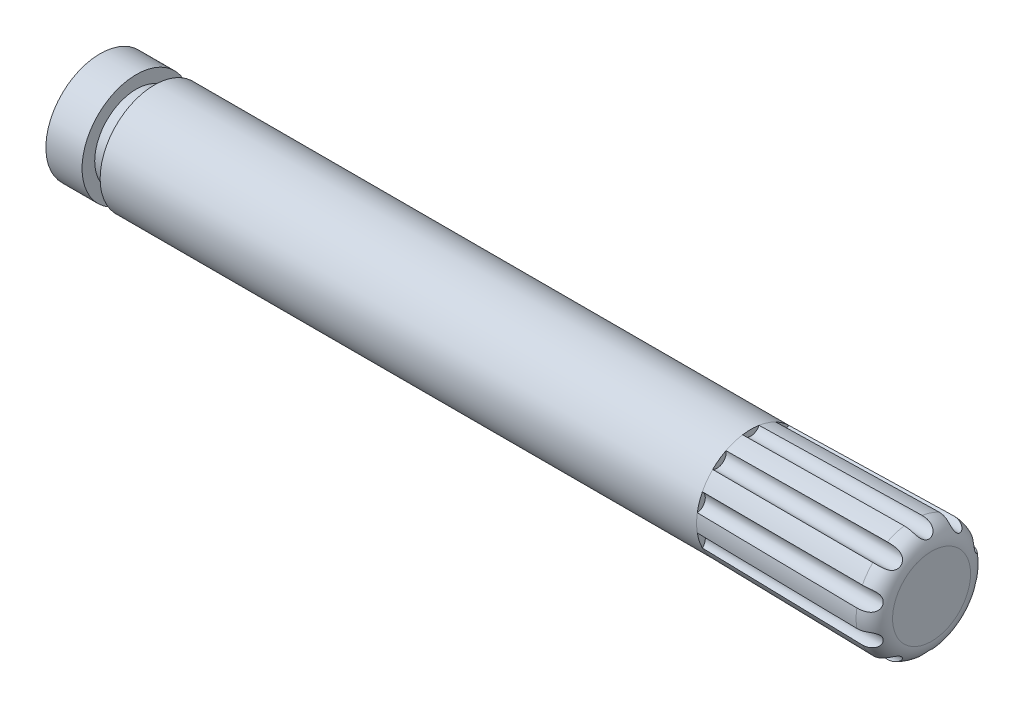
from build123d import *

# Parameters (mm, degrees)
SKETCH1_R                = 1.5
EXTRUDE1_DEPTH           = 18
EXTRUDE1_OTHER_WAY_DEPTH = 5
EXTRUDE1_OTHER_WAY_TAPER = -1
FILLET1_R                = 0.5
SKETCH2_R                = 0.25
CUT_EXTRUDE1_DEPTH       = 5
CIRPATTERN1_COUNT        = 10
SKETCH3_W                = 0.5
SKETCH3_H                = 0.930924855


with BuildPart() as part:
    # Sketch1 → Extrude1 (new body)
    with BuildSketch(Plane(origin=(0, 0, 0), x_dir=(0, 0, -1), z_dir=(1, 0, 0))):
        Circle(SKETCH1_R)
    extrude(amount=-EXTRUDE1_DEPTH)

    # Sketch1 → Extrude1 other way (add)
    with BuildSketch(Plane(origin=(0, 0, 0), x_dir=(0, 0, -1), z_dir=(1, 0, 0))):
        Circle(SKETCH1_R)
    extrude(amount=EXTRUDE1_OTHER_WAY_DEPTH, taper=EXTRUDE1_OTHER_WAY_TAPER)

    # Fillet1
    fillet1_edges = [part.edges().sort_by_distance(p)[0] for p in [
        (5, 0, 1.587275325),
    ]]
    fillet(fillet1_edges, radius=FILLET1_R)

    # Sketch2 → Cut-Extrude1 (cut)
    with BuildSketch(Plane(origin=(5, 0, 0), x_dir=(0, 0, -1), z_dir=(1, 0, 0))):
        with Locations((0, 1.587275325)):
            Circle(SKETCH2_R)
    cut_extrude1 = extrude(amount=-CUT_EXTRUDE1_DEPTH, mode=Mode.SUBTRACT)

    # CirPattern1: Cut-Extrude1 ×10 about axis
    cirpattern1_axis = Axis((0, 0, 0), (1, 0, 0))
    for i in range(1, CIRPATTERN1_COUNT):
        add(cut_extrude1.rotate(cirpattern1_axis, i * 360 / CIRPATTERN1_COUNT), mode=Mode.SUBTRACT)

    # Sketch3 → Cut-Revolve2 (revolve, cut)
    with BuildSketch(Plane.XY, mode=Mode.PRIVATE) as cut_revolve2_sk:
        with Locations((-16.75, 1.615462428)):
            Rectangle(SKETCH3_W, SKETCH3_H)
    revolve(cut_revolve2_sk.sketch.rotate(Axis((-18, 0, 0), (1, 0, 0)), 260.707387505), axis=Axis((-18, 0, 0), (1, 0, 0)), mode=Mode.SUBTRACT)


solid = part.part
